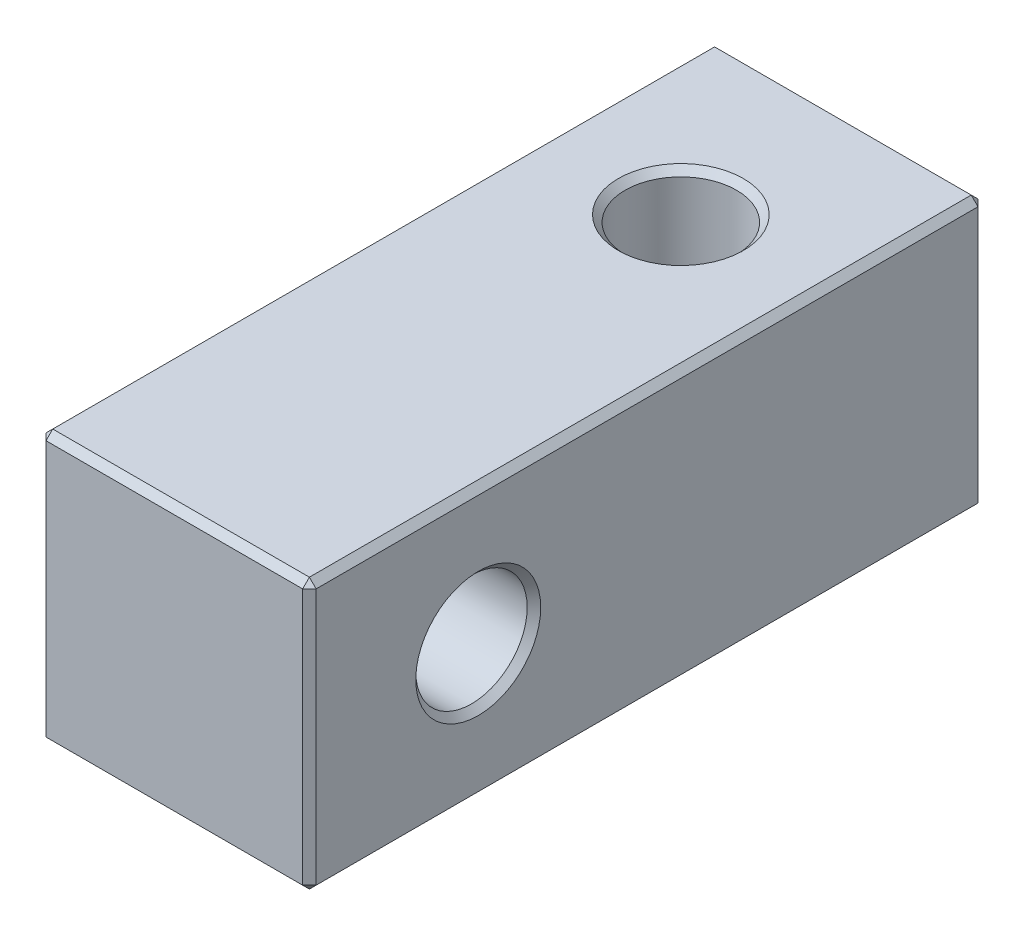
from build123d import *

# Parameters (mm, degrees)
SKETCH_1_W         = 8
SKETCH_1_H         = 8
EXTRUDE_1_DEPTH    = 10
HOLE_WIZARD_M4_1_D = 3.3
HOLE_WIZARD_M4_2_D = 3.3
CHAMFER_1_SIZE     = 0.2


with BuildPart() as part:
    # 草图1 → 凸台-拉伸1 (new, symmetric)
    with BuildSketch(Plane.XY):
        Rectangle(SKETCH_1_W, SKETCH_1_H)
    extrude(amount=EXTRUDE_1_DEPTH, both=True)

    # M4 螺纹孔1 (through all)
    with Locations(Plane(origin=(4, 0, 0), x_dir=(0, 0, -1), z_dir=(1, 0, 0))):
        with Locations((-5, 0)):
            Hole(HOLE_WIZARD_M4_1_D / 2)

    # M4 螺纹孔2 (through all)
    with Locations(Plane(origin=(0, 4, 0), x_dir=(1, 0, 0), z_dir=(0, 1, 0))):
        with Locations((0, 5)):
            Hole(HOLE_WIZARD_M4_2_D / 2)

    # 倒角1
    chamfer_1_edges = [part.edges().sort_by_distance(p)[0] for p in [
        (-4, 0, 10),
        (4, 0, 3.35),
        (-4, 0, 3.35),
        (0, -4, 10),
        (1.65, 4, -5),
        (1.65, -4, -5),
        (4, 0, 10),
        (0, -4, -10),
        (-4, 0, -10),
        (0, 4, -10),
        (4, 0, -10),
        (4, -4, 0),
        (-4, -4, 0),
        (-4, 4, 0),
        (4, 4, 0),
        (0, 4, 10),
    ]]
    chamfer(chamfer_1_edges, length=CHAMFER_1_SIZE)


solid = part.part
